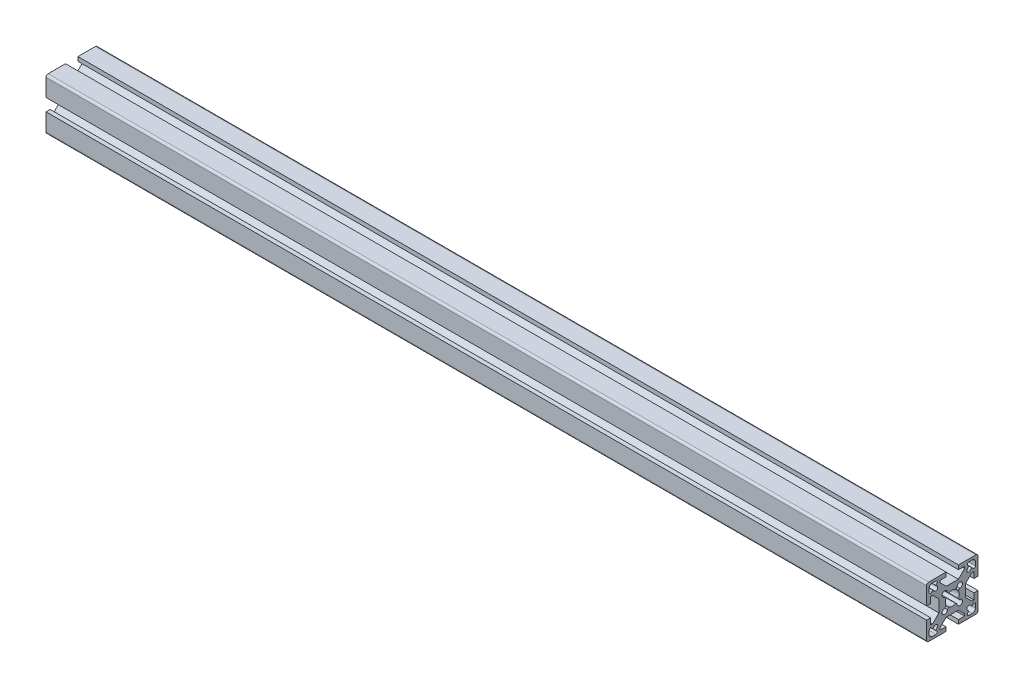
from build123d import *

# Parameters (mm, degrees)
BOSS_EXTRUDE1_DEPTH = 428


with BuildPart() as part:
    # Sketch1 → Boss-Extrude1 (new body)
    with BuildSketch(Plane(origin=(0, 0, 0), x_dir=(0, 0, -1), z_dir=(1, 0, 0))):
        with BuildLine():
            Line((-12.5, 11.5), (-12.5, 3))
            Line((-12.5, 3), (-10.5, 3))
            Line((-10.5, 3), (-10.5, 6))
            Line((-10.5, 6), (-9.535533906, 6))
            Line((-9.535533906, 6), (-6.5, 2.964466094))
            Line((-6.5, 2.964466094), (-6.5, -2.964466094))
            Line((-6.5, -2.964466094), (-9.535533906, -6))
            Line((-9.535533906, -6), (-10.5, -6))
            Line((-10.5, -6), (-10.5, -3))
            Line((-10.5, -3), (-12.5, -3))
            Line((-12.5, -3), (-12.5, -11.5))
            ThreePointArc((-12.5, -11.5), (-12.207106781, -12.207106781), (-11.5, -12.5))
            Line((-11.5, -12.5), (-3, -12.5))
            Line((-3, -12.5), (-3, -10.5))
            Line((-3, -10.5), (-6, -10.5))
            Line((-6, -10.5), (-6, -9.535533906))
            Line((-6, -9.535533906), (-2.964466094, -6.5))
            Line((-2.964466094, -6.5), (2.964466094, -6.5))
            Line((2.964466094, -6.5), (6, -9.535533906))
            Line((6, -9.535533906), (6, -10.5))
            Line((6, -10.5), (3, -10.5))
            Line((3, -10.5), (3, -12.5))
            Line((3, -12.5), (11.5, -12.5))
            ThreePointArc((11.5, -12.5), (12.207106781, -12.207106781), (12.5, -11.5))
            Line((12.5, -11.5), (12.5, -3))
            Line((12.5, -3), (10.5, -3))
            Line((10.5, -3), (10.5, -6))
            Line((10.5, -6), (9.535533906, -6))
            Line((9.535533906, -6), (6.5, -2.964466094))
            Line((6.5, -2.964466094), (6.5, 2.964466094))
            Line((6.5, 2.964466094), (9.535533906, 6))
            Line((9.535533906, 6), (10.5, 6))
            Line((10.5, 6), (10.5, 3))
            Line((10.5, 3), (12.5, 3))
            Line((12.5, 3), (12.5, 11.5))
            ThreePointArc((12.5, 11.5), (12.207106781, 12.207106781), (11.5, 12.5))
            Line((11.5, 12.5), (3, 12.5))
            Line((3, 12.5), (3, 10.5))
            Line((3, 10.5), (6, 10.5))
            Line((6, 10.5), (6, 9.535533906))
            Line((6, 9.535533906), (2.964466094, 6.5))
            Line((2.964466094, 6.5), (-2.964466094, 6.5))
            Line((-2.964466094, 6.5), (-6, 9.535533906))
            Line((-6, 9.535533906), (-6, 10.5))
            Line((-6, 10.5), (-3, 10.5))
            Line((-3, 10.5), (-3, 12.5))
            Line((-3, 12.5), (-11.5, 12.5))
            ThreePointArc((-11.5, 12.5), (-12.207106781, 12.207106781), (-12.5, 11.5))
        make_face()
        with BuildLine():
            Line((-3.087755464, -1.885673936), (-3.585519377, -2.383437849))
            ThreePointArc((-3.585519377, -2.383437849), (-4.599238816, -4.599238816), (-2.383437849, -3.585519377))
            Line((-2.383437849, -3.585519377), (-1.885673936, -3.087755464))
            ThreePointArc((-1.885673936, -3.087755464), (-1.720751743, -3.0036254), (-1.537849315, -3.032329053))
            ThreePointArc((-1.537849315, -3.032329053), (0, -3.4), (1.537849315, -3.032329053))
            ThreePointArc((1.537849315, -3.032329053), (1.720751743, -3.0036254), (1.885673936, -3.087755464))
            Line((1.885673936, -3.087755464), (2.383437849, -3.585519377))
            ThreePointArc((2.383437849, -3.585519377), (4.599238816, -4.599238816), (3.585519377, -2.383437849))
            Line((3.585519377, -2.383437849), (3.087755464, -1.885673936))
            ThreePointArc((3.087755464, -1.885673936), (3.0036254, -1.720751743), (3.032329053, -1.537849315))
            ThreePointArc((3.032329053, -1.537849315), (3.4, 0), (3.032329053, 1.537849315))
            ThreePointArc((3.032329053, 1.537849315), (3.0036254, 1.720751743), (3.087755464, 1.885673936))
            Line((3.087755464, 1.885673936), (3.585519377, 2.383437849))
            ThreePointArc((3.585519377, 2.383437849), (4.599238816, 4.599238816), (2.383437849, 3.585519377))
            Line((2.383437849, 3.585519377), (1.885673936, 3.087755464))
            ThreePointArc((1.885673936, 3.087755464), (1.720751743, 3.0036254), (1.537849315, 3.032329053))
            ThreePointArc((1.537849315, 3.032329053), (0, 3.4), (-1.537849315, 3.032329053))
            ThreePointArc((-1.537849315, 3.032329053), (-1.720751743, 3.0036254), (-1.885673936, 3.087755464))
            Line((-1.885673936, 3.087755464), (-2.383437849, 3.585519377))
            ThreePointArc((-2.383437849, 3.585519377), (-4.599238816, 4.599238816), (-3.585519377, 2.383437849))
            Line((-3.585519377, 2.383437849), (-3.087755464, 1.885673936))
            ThreePointArc((-3.087755464, 1.885673936), (-3.0036254, 1.720751743), (-3.032329053, 1.537849315))
            ThreePointArc((-3.032329053, 1.537849315), (-3.4, 0), (-3.032329053, -1.537849315))
            ThreePointArc((-3.032329053, -1.537849315), (-3.0036254, -1.720751743), (-3.087755464, -1.885673936))
        make_face(mode=Mode.SUBTRACT)
        with BuildLine():
            Line((-11.25, 9.75), (-11.25, 7.976197667))
            ThreePointArc((-11.25, 7.976197667), (-10.817878403, 7.329481994), (-10.055025253, 7.48122292))
            Line((-10.055025253, 7.48122292), (-9.475230868, 8.061017306))
            Line((-9.475230868, 8.061017306), (-8.768124087, 7.353910524))
            ThreePointArc((-8.768124087, 7.353910524), (-7.353910524, 7.353910524), (-7.353910524, 8.768124087))
            Line((-7.353910524, 8.768124087), (-8.061017306, 9.475230868))
            Line((-8.061017306, 9.475230868), (-7.48122292, 10.055025253))
            ThreePointArc((-7.48122292, 10.055025253), (-7.329481994, 10.817878403), (-7.976197667, 11.25))
            Line((-7.976197667, 11.25), (-9.75, 11.25))
            ThreePointArc((-9.75, 11.25), (-10.810660172, 10.810660172), (-11.25, 9.75))
        make_face(mode=Mode.SUBTRACT)
        with BuildLine():
            Line((8.061017306, 9.475230868), (7.353910524, 8.768124087))
            ThreePointArc((7.353910524, 8.768124087), (7.353910524, 7.353910524), (8.768124087, 7.353910524))
            Line((8.768124087, 7.353910524), (9.475230868, 8.061017306))
            Line((9.475230868, 8.061017306), (10.055025253, 7.48122292))
            ThreePointArc((10.055025253, 7.48122292), (10.817878403, 7.329481994), (11.25, 7.976197667))
            Line((11.25, 7.976197667), (11.25, 9.75))
            ThreePointArc((11.25, 9.75), (10.810660172, 10.810660172), (9.75, 11.25))
            Line((9.75, 11.25), (7.976197667, 11.25))
            ThreePointArc((7.976197667, 11.25), (7.329481994, 10.817878403), (7.48122292, 10.055025253))
            Line((7.48122292, 10.055025253), (8.061017306, 9.475230868))
        make_face(mode=Mode.SUBTRACT)
        with BuildLine():
            Line((-9.475230868, -8.061017306), (-10.055025253, -7.48122292))
            ThreePointArc((-10.055025253, -7.48122292), (-10.817878403, -7.329481994), (-11.25, -7.976197667))
            Line((-11.25, -7.976197667), (-11.25, -9.75))
            ThreePointArc((-11.25, -9.75), (-10.810660172, -10.810660172), (-9.75, -11.25))
            Line((-9.75, -11.25), (-7.976197667, -11.25))
            ThreePointArc((-7.976197667, -11.25), (-7.329481994, -10.817878403), (-7.48122292, -10.055025253))
            Line((-7.48122292, -10.055025253), (-8.061017306, -9.475230868))
            Line((-8.061017306, -9.475230868), (-7.353910524, -8.768124087))
            ThreePointArc((-7.353910524, -8.768124087), (-7.353910524, -7.353910524), (-8.768124087, -7.353910524))
            Line((-8.768124087, -7.353910524), (-9.475230868, -8.061017306))
        make_face(mode=Mode.SUBTRACT)
        with BuildLine():
            Line((9.475230868, -8.061017306), (8.768124087, -7.353910524))
            ThreePointArc((8.768124087, -7.353910524), (7.353910524, -7.353910524), (7.353910524, -8.768124087))
            Line((7.353910524, -8.768124087), (8.061017306, -9.475230868))
            Line((8.061017306, -9.475230868), (7.48122292, -10.055025253))
            ThreePointArc((7.48122292, -10.055025253), (7.329481994, -10.817878403), (7.976197667, -11.25))
            Line((7.976197667, -11.25), (9.75, -11.25))
            ThreePointArc((9.75, -11.25), (10.810660172, -10.810660172), (11.25, -9.75))
            Line((11.25, -9.75), (11.25, -7.976197667))
            ThreePointArc((11.25, -7.976197667), (10.817878403, -7.329481994), (10.055025253, -7.48122292))
            Line((10.055025253, -7.48122292), (9.475230868, -8.061017306))
        make_face(mode=Mode.SUBTRACT)
    extrude(amount=BOSS_EXTRUDE1_DEPTH)


solid = part.part
